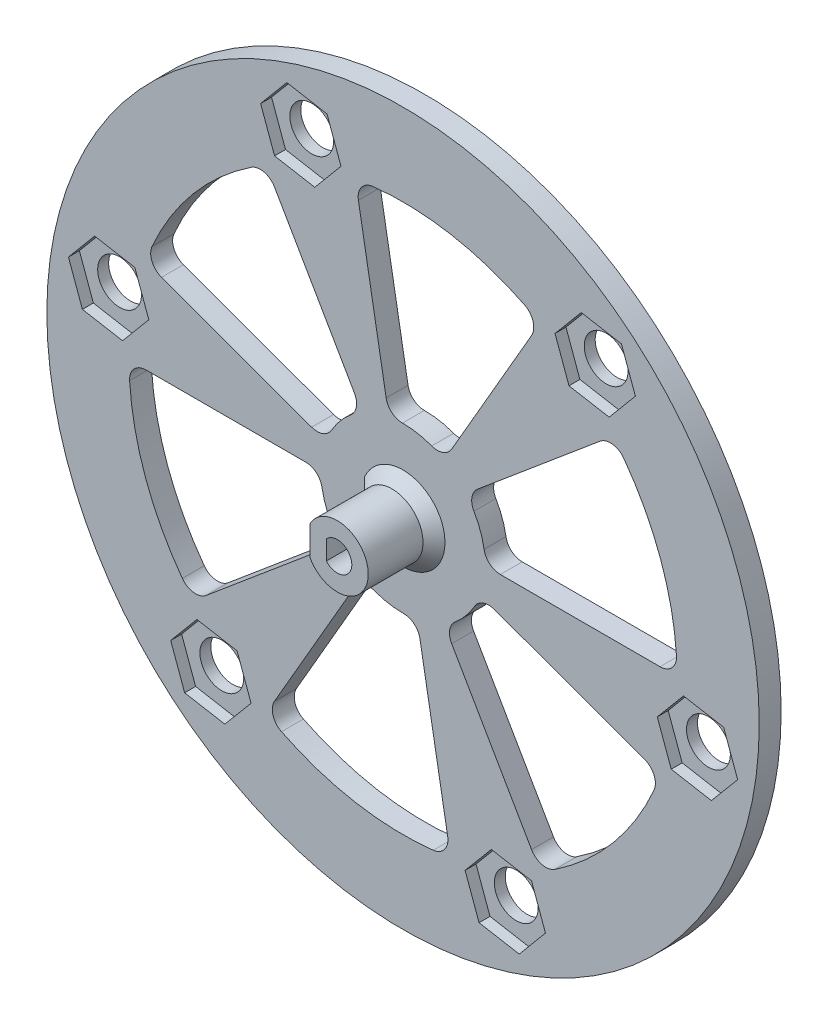
from build123d import *

# Parameters (mm, degrees)
ESQUISSE1_R                        = 65
BOSS_EXTRU_1_DEPTH                 = 4
ENL_V_MAT_EXTRU_1_DEPTH            = 93.010868923
BOSS_EXTRU_2_START                 = 12
BOSS_EXTRU_2_DEPTH                 = 12
ENL_V_MAT_EXTRU_2_REACH            = 98.856
ESQUISSE4_R                        = 1.5
CHANFREIN1_SIZE                    = 2
ENL_V_MAT_EXTRU_3_REACH            = 94.704
CONG_1_R                           = 3
ENL_V_MAT_EXTRU_4_DEPTH            = 2
ENL_V_MAT_EXTRU_5_REACH            = 94.984
ESQUISSE8_R                        = 4
R_P_TITION_CIRCULAIRE1_COUNT       = 6
CONG_1_OF_R_P_TITION_CIRCULAIRE1_R = 3


with BuildPart() as part:
    # Esquisse1 → Boss.-Extru.1 (new body)
    with BuildSketch(Plane.XY):
        Circle(ESQUISSE1_R)
    extrude(amount=BOSS_EXTRU_1_DEPTH)

    # Esquisse2 → Enlèv. mat.-Extru.1 (cut, through all)
    with BuildSketch(Plane.XY.offset(4)):
        with BuildLine():
            Line((-2, 1.738533865), (-2, -1.738533865))
            ThreePointArc((-2, -1.738533865), (2.65, 0), (-2, 1.738533865))
        make_face()
    extrude(amount=-ENL_V_MAT_EXTRU_1_DEPTH, mode=Mode.SUBTRACT)

    # Esquisse3 → Boss.-Extru.2 (add)
    with BuildSketch(Plane.XY.offset(4).offset(BOSS_EXTRU_2_START)):
        with BuildLine():
            Line((-5, 2.631064423), (-5, -2.631064423))
            ThreePointArc((-5, -2.631064423), (5.65, 0), (-5, 2.631064423))
        make_face()
        with BuildLine():
            Line((-2, 1.738533865), (-2, -1.738533865))
            ThreePointArc((-2, -1.738533865), (2.65, 0), (-2, 1.738533865))
        make_face(mode=Mode.SUBTRACT)
    extrude(amount=-BOSS_EXTRU_2_DEPTH)

    # Esquisse4 → Enlèv. mat.-Extru.2 (cut, up to next)
    with BuildSketch(Plane.ZY.offset(5), mode=Mode.PRIVATE) as enl_v_mat_extru_2_sk1:
        with Locations((10, 0)):
            Circle(ESQUISSE4_R)
    enl_v_mat_extru_2_tool1 = extrude(enl_v_mat_extru_2_sk1.sketch, amount=-ENL_V_MAT_EXTRU_2_REACH, mode=Mode.PRIVATE) & part.part
    add(enl_v_mat_extru_2_tool1.solids().sort_by_distance((-5, 0, 10))[0], mode=Mode.SUBTRACT)

    # Chanfrein1
    chanfrein1_edges = [part.edges().sort_by_distance(p)[0] for p in [
        (-5, 0, 4),
        (5.65, 0, 4),
    ]]
    chamfer(chanfrein1_edges, length=CHANFREIN1_SIZE)

    # Esquisse5 → Enlèv. mat.-Extru.3 (cut, up to next)
    with BuildSketch(Plane.XY.offset(4), mode=Mode.PRIVATE) as enl_v_mat_extru_3_sk1:
        with BuildLine():
            Line((14.095389312, -5.13030215), (46.984631039, -17.101007166))
            ThreePointArc((46.984631039, -17.101007166), (38.302222156, -32.139380484), (25, -43.301270189))
            Line((25, -43.301270189), (7.5, -12.990381057))
            ThreePointArc((7.5, -12.990381057), (11.490666647, -9.641814145), (14.095389312, -5.13030215))
        make_face()
    enl_v_mat_extru_3_tool1 = extrude(enl_v_mat_extru_3_sk1.sketch, amount=-ENL_V_MAT_EXTRU_3_REACH, mode=Mode.PRIVATE) & part.part
    enl_v_mat_extru_3 = enl_v_mat_extru_3_tool1.solids().sort_by_distance((26.751521, -22.447191, 4))[0]
    add(enl_v_mat_extru_3, mode=Mode.SUBTRACT)

    # Congé1
    cong_1_edges = [part.edges().sort_by_distance(p)[0] for p in [
        (25, -43.301270189, 2),
        (46.984631039, -17.101007166, 2),
        (7.5, -12.990381057, 2),
        (14.095389312, -5.13030215, 2),
    ]]
    fillet(cong_1_edges, radius=CONG_1_R)

    # Esquisse7 → Enlèv. mat.-Extru.4 (cut)
    with BuildSketch(Plane.XY.offset(4)):
        Polygon((61.058080687, -10.766187015), (58.510776745, -3.767526956), (51.176107371, -2.47422685), (46.388741937, -8.179586805), (48.936045879, -15.178246864), (56.270715253, -16.47154697), align=None)
    enl_v_mat_extru_4 = extrude(amount=-ENL_V_MAT_EXTRU_4_DEPTH, mode=Mode.SUBTRACT)

    # Esquisse8 → Enlèv. mat.-Extru.5 (cut, up to next)
    with BuildSketch(Plane.XY.offset(2), mode=Mode.PRIVATE) as enl_v_mat_extru_5_sk1:
        with Locations((53.723411312, -9.47288691)):
            Circle(ESQUISSE8_R)
    enl_v_mat_extru_5_tool1 = extrude(enl_v_mat_extru_5_sk1.sketch, amount=-ENL_V_MAT_EXTRU_5_REACH, mode=Mode.PRIVATE) & part.part
    enl_v_mat_extru_5 = enl_v_mat_extru_5_tool1.solids().sort_by_distance((53.723411, -9.472887, 2))[0]
    add(enl_v_mat_extru_5, mode=Mode.SUBTRACT)

    # Répétition circulaire1: Enlèv. mat.-Extru.3, Enlèv. mat.-Extru.4, Enlèv. mat.-Extru.5 ×6 about axis
    r_p_tition_circulaire1_axis = Axis((0, 0, -0.8), (0, 0, 1))
    add([enl_v_mat_extru_3.rotate(r_p_tition_circulaire1_axis, i * 360 / R_P_TITION_CIRCULAIRE1_COUNT) for i in range(1, R_P_TITION_CIRCULAIRE1_COUNT)], mode=Mode.SUBTRACT)
    add([enl_v_mat_extru_4.rotate(r_p_tition_circulaire1_axis, i * 360 / R_P_TITION_CIRCULAIRE1_COUNT) for i in range(1, R_P_TITION_CIRCULAIRE1_COUNT)], mode=Mode.SUBTRACT)
    add([enl_v_mat_extru_5.rotate(r_p_tition_circulaire1_axis, i * 360 / R_P_TITION_CIRCULAIRE1_COUNT) for i in range(1, R_P_TITION_CIRCULAIRE1_COUNT)], mode=Mode.SUBTRACT)

    # Congé1 of Répétition circulaire1
    cong_1_of_r_p_tition_circulaire1_edges = [part.edges().sort_by_distance(p)[0] for p in [
        (50, 0, 2),
        (38.302222156, 32.139380484, 2),
        (15, 0, 2),
        (11.490666647, 9.641814145, 2),
        (25, 43.301270189, 2),
        (-8.682408883, 49.240387651, 2),
        (7.5, 12.990381057, 2),
        (-2.604722665, 14.772116295, 2),
        (-25, 43.301270189, 2),
        (-46.984631039, 17.101007166, 2),
        (-7.5, 12.990381057, 2),
        (-14.095389312, 5.13030215, 2),
        (-50, 0, 2),
        (-38.302222156, -32.139380484, 2),
        (-15, 0, 2),
        (-11.490666647, -9.641814145, 2),
        (-25, -43.301270189, 2),
        (8.682408883, -49.240387651, 2),
        (-7.5, -12.990381057, 2),
        (2.604722665, -14.772116295, 2),
    ]]
    fillet(cong_1_of_r_p_tition_circulaire1_edges, radius=CONG_1_OF_R_P_TITION_CIRCULAIRE1_R)


solid = part.part
